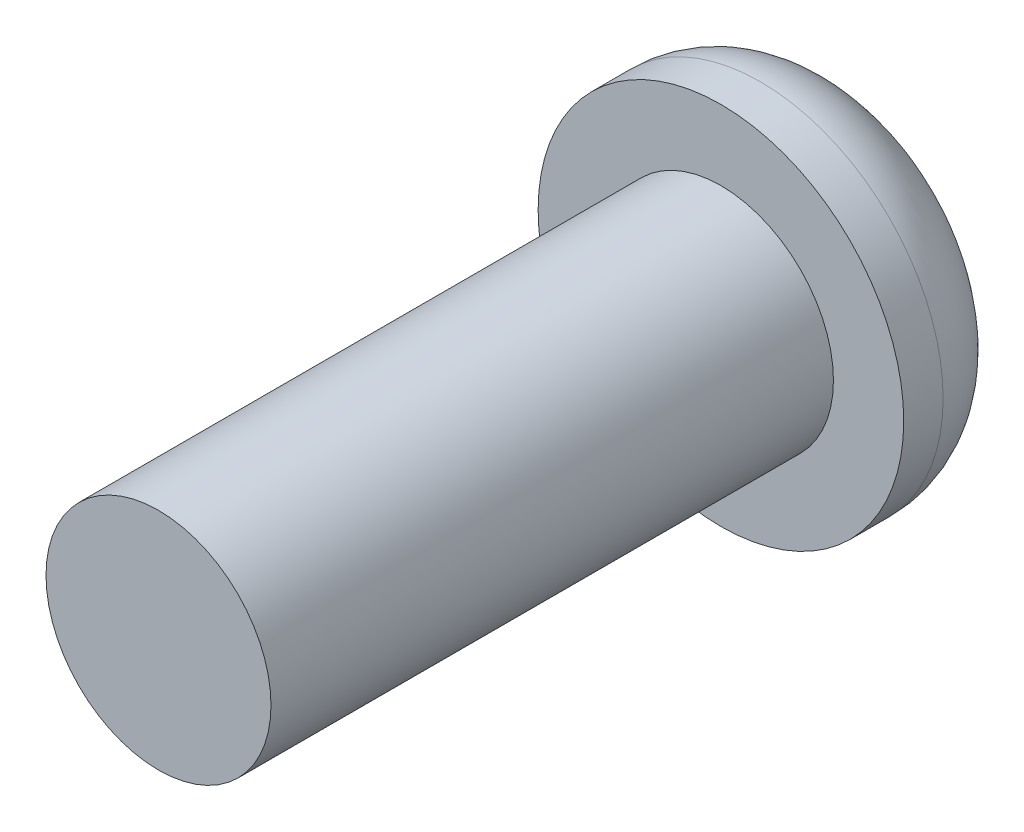
from build123d import *

# Parameters (mm, degrees)
SKETCH_1_R      = 2
EXTRUDE_1_DEPTH = 10
SKETCH_2_R      = 3.25
EXTRUDE_2_DEPTH = 2.2
FILLET_1_R      = 1.5


with BuildPart() as part:
    # Sketch 1 → 凸台-拉伸1 (new body)
    with BuildSketch(Plane.XY):
        Circle(SKETCH_1_R)
    extrude(amount=EXTRUDE_1_DEPTH)

    # 草图2 → 凸台-拉伸2 (add)
    with BuildSketch(Plane(origin=(0, 0, 0), x_dir=(-1, 0, 0), z_dir=(0, 0, -1))):
        Circle(SKETCH_2_R)
    extrude(amount=EXTRUDE_2_DEPTH)

    # 圆角1
    fillet_1_edges = [part.edges().sort_by_distance(p)[0] for p in [
        (3.25, 0, -2.2),
    ]]
    fillet(fillet_1_edges, radius=FILLET_1_R)


solid = part.part
